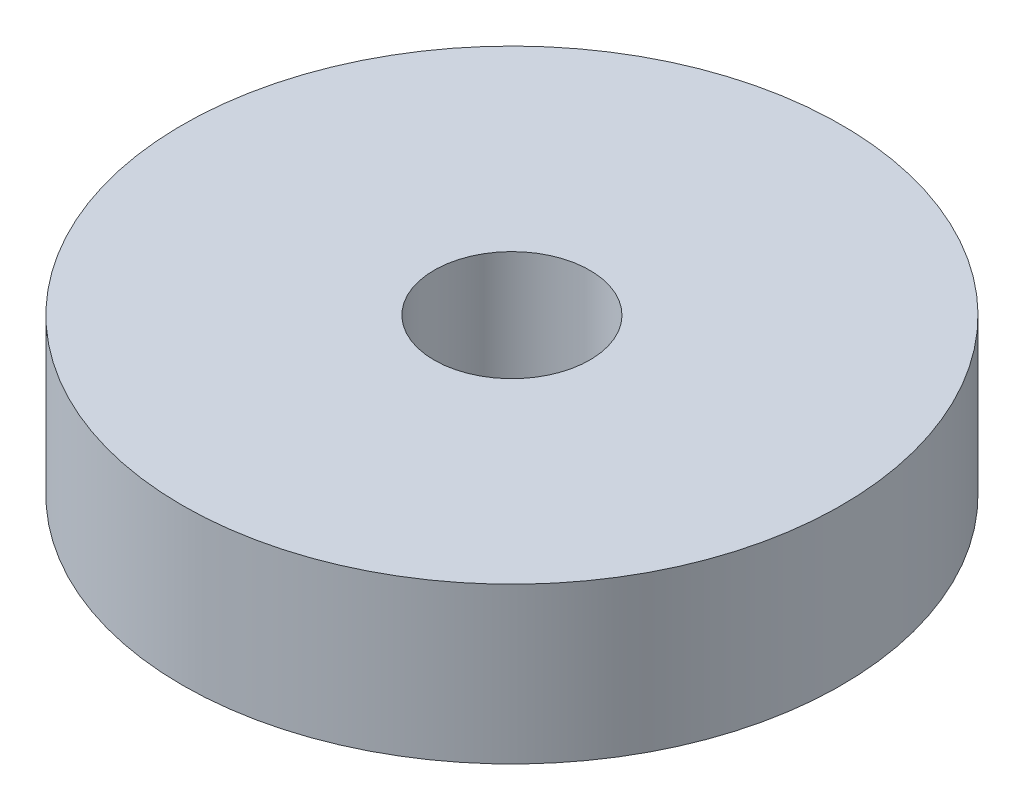
from build123d import *

# Parameters (mm, degrees)
SKETCH1_R           = 12.7
SKETCH1_R_2         = 3
BOSS_EXTRUDE1_DEPTH = 6


with BuildPart() as part:
    # Sketch1 → Boss-Extrude1 (new body)
    with BuildSketch(Plane(origin=(0, 0, 0), x_dir=(1, 0, 0), z_dir=(0, 1, 0))):
        with Locations(Location((0, 0, 0), (0, 0, 270))):
            Circle(SKETCH1_R)
        with Locations(Location((0, 0, 0), (0, 0, 270))):
            Circle(SKETCH1_R_2, mode=Mode.SUBTRACT)
    extrude(amount=BOSS_EXTRUDE1_DEPTH)


solid = part.part
